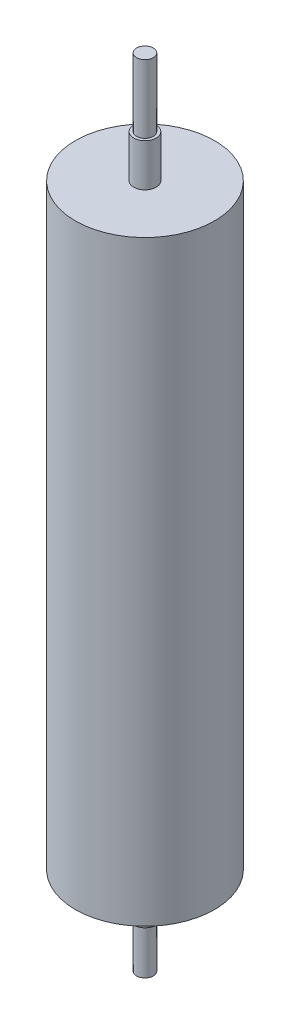
from build123d import *

# Parameters (mm, degrees)
SKETCH1_R            = 24.5
BOSS_EXTRUDE8_DEPTH  = 210
SKETCH1_9_R          = 3.95
BOSS_EXTRUDE9_DEPTH  = 15
BOSS_EXTRUDE10_START = -15
SKETCH1_10_R         = 2.95
BOSS_EXTRUDE10_DEPTH = 16
BOSS_EXTRUDE11_START = 225
SKETCH1_11_R         = 3.95
BOSS_EXTRUDE11_DEPTH = 15
BOSS_EXTRUDE12_START = 24
SKETCH2_R            = 2.95
BOSS_EXTRUDE12_DEPTH = 24


with BuildPart() as part:
    # Sketch1 → Boss-Extrude8 (new body)
    with BuildSketch(Plane(origin=(0, 0, 0), x_dir=(1, 0, 0), z_dir=(0, 1, 0))):
        with Locations(Location((0, 0, 0), (0, 0, 270))):
            Circle(SKETCH1_R)
    extrude(amount=BOSS_EXTRUDE8_DEPTH)

    # Sketch1<9> → Boss-Extrude9 (add)
    with BuildSketch(Plane(origin=(0, 0, 0), x_dir=(1, 0, 0), z_dir=(0, 1, 0))):
        with Locations(Location((0, 0, 0), (0, 0, 270))):
            Circle(SKETCH1_9_R)
    extrude(amount=-BOSS_EXTRUDE9_DEPTH)

    # Sketch1<10> → Boss-Extrude10 (add)
    with BuildSketch(Plane(origin=(0, 0, 0), x_dir=(1, 0, 0), z_dir=(0, 1, 0)).offset(BOSS_EXTRUDE10_START)):
        with Locations(Location((0, 0, 0), (0, 0, 270))):
            Circle(SKETCH1_10_R)
    extrude(amount=-BOSS_EXTRUDE10_DEPTH)

    # Sketch1<11> → Boss-Extrude11 (add)
    with BuildSketch(Plane(origin=(0, 0, 0), x_dir=(1, 0, 0), z_dir=(0, 1, 0)).offset(BOSS_EXTRUDE11_START)):
        with Locations(Location((0, 0, 0), (0, 0, 270))):
            Circle(SKETCH1_11_R)
    extrude(amount=-BOSS_EXTRUDE11_DEPTH)

    # Sketch2 → Boss-Extrude12 (add)
    with BuildSketch(Plane(origin=(0, 225, 0), x_dir=(1, 0, 0), z_dir=(0, 1, 0)).offset(BOSS_EXTRUDE12_START)):
        with Locations(Location((0, 0, 0), (0, 0, 270))):
            Circle(SKETCH2_R)
    extrude(amount=-BOSS_EXTRUDE12_DEPTH)


solid = part.part
